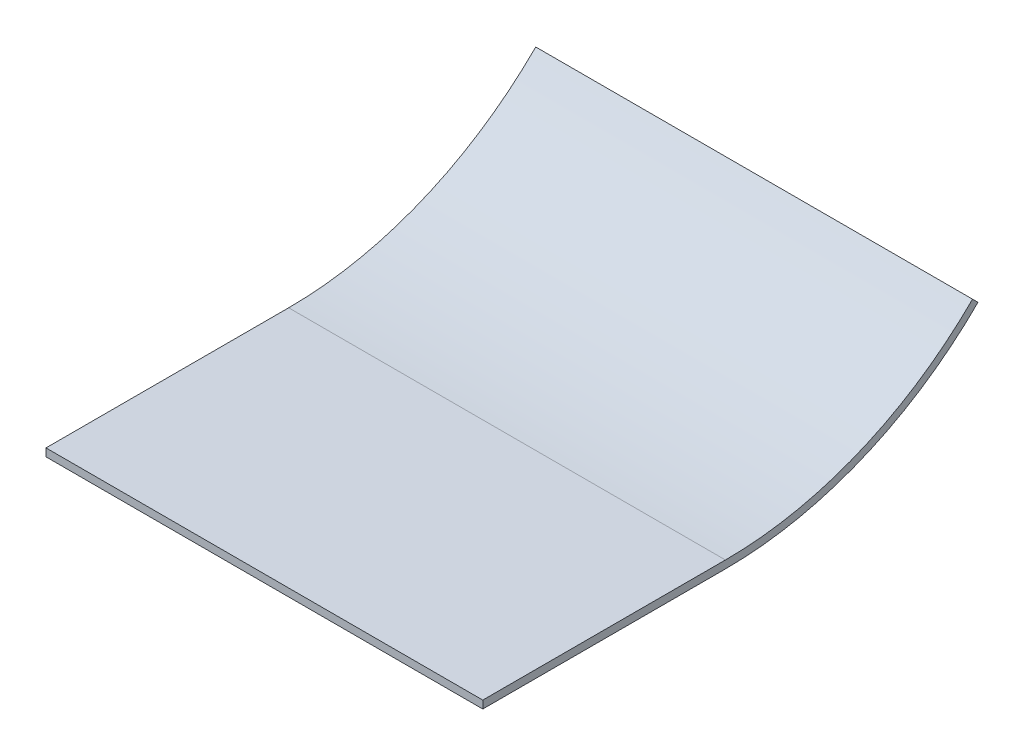
from build123d import *

# Parameters (mm, degrees)
EXTRUDE_1_DEPTH = 45


with BuildPart() as part:
    # 草图1 → 拉伸-薄壁1 (new body)
    with BuildSketch(Plane(origin=(0, 0, 0), x_dir=(0, 0, -1), z_dir=(1, 0, 0))):
        with BuildLine():
            Line((0, 0), (25, 0))
            ThreePointArc((25, 0), (38.776603565, 2.74033683), (50.455844123, 10.544155877))
            Line((50.455844123, 10.544155877), (51.021529548, 9.978470452))
            ThreePointArc((51.021529548, 9.978470452), (39.082750311, 2.001233204), (25, -0.8))
            Line((25, -0.8), (0, -0.8))
            Line((0, -0.8), (0, 0))
        make_face()
    extrude(amount=EXTRUDE_1_DEPTH)


solid = part.part
